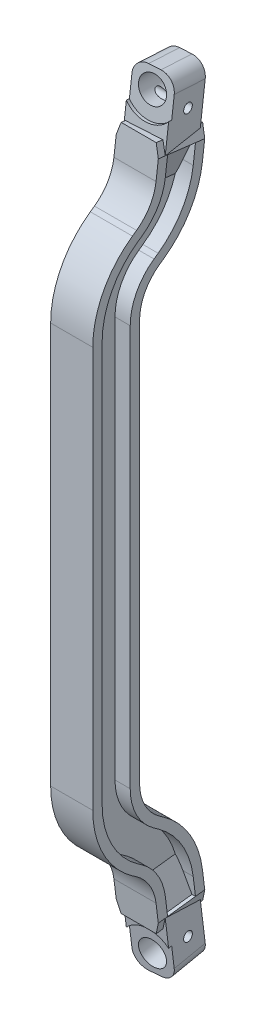
from build123d import *
from OCP.BRepFilletAPI import BRepFilletAPI_MakeChamfer

# Parameters (mm, degrees)
BOSS_EXTRUDE3_DEPTH       = 100
BOSS_EXTRUDE4_START       = -25
BOSS_EXTRUDE4_DEPTH       = 135
FILLET2_R                 = 30
SKETCH8_R                 = 28
CUT_EXTRUDE2_DEPTH        = 85
CHAMFER2_SIZE             = 25
CHAMFER2_SIZE2            = 68.686935486
SKETCH9_R                 = 10
CUT_EXTRUDE3_DEPTH        = 858.264154976
FILLET2_OF_MIRROR1_R      = 30
CHAMFER2_OF_MIRROR1_SIZE  = 25
CHAMFER2_OF_MIRROR1_SIZE2 = 68.686935486
SKETCH10_R                = 55
CUT_EXTRUDE4_DEPTH        = 7
SKETCH11_R                = 55
CUT_EXTRUDE5_DEPTH        = 7


with BuildPart() as part:
    # Sweep3: sweep along a path in Sketch2
    with BuildLine(Plane(origin=(0, 0, 0), x_dir=(0, 0, -1), z_dir=(1, 0, 0))) as sweep3_path:
        Line((40, -707.115), (35.150009844, -667.615))
        ThreePointArc((35.150009844, -667.615), (21.699722473, -628.444195566), (-6.468256478, -598.082589677))
        Line((-6.468256478, -598.082589677), (-15.272697684, -591.87285015))
        ThreePointArc((-15.272697684, -591.87285015), (-77.559200743, -520.481595506), (-100, -428.434160824))
        Line((-100, -428.434160824), (-100, -372.115))
        Line((-100, -372.115), (-100, 0))
    # Sketch1 → Sweep3 (sweep)
    with BuildSketch(Plane(origin=(0, 0, 0), x_dir=(1, 0, 0), z_dir=(0, 1, 0))):
        Polygon((-45, 0), (-45, -20), (-12.5, -20), (-12.5, -80), (-45, -80), (-45, -100), (45, -100), (45, -80), (12.5, -80), (12.5, -20), (45, -20), (45, 0), align=None)
    sweep3 = sweep(path=sweep3_path.line)

    # Sketch6 → Boss-Extrude3 (add)
    with BuildSketch(Plane(origin=(0, 6.523203495, -53.127229086), x_dir=(-1, 0, 0), z_dir=(0, 0.12186934340514098, -0.992546151641323))):
        Polygon((-45, -706.719045754), (45, -706.719045754), (37.5, -731.719045754), (-37.5, -731.719045754), align=None)
    boss_extrude3 = extrude(amount=-BOSS_EXTRUDE3_DEPTH)

    # Sketch7 → Boss-Extrude4 (add)
    with BuildSketch(Plane(origin=(0, -726.264922946, -89.174119663), x_dir=(1, 0, 0), z_dir=(0, -0.992546151641323, -0.12186934340514098)).offset(BOSS_EXTRUDE4_START)):
        Polygon((-39.489238574, 37.473794696), (45, 31.565731599), (39.489238574, -47.241828371), (-45, -41.333765274), align=None)
    boss_extrude4 = extrude(amount=BOSS_EXTRUDE4_DEPTH)

    # Fillet2
    fillet2_edges = [part.edges().sort_by_distance(p)[0] for p in [
        (-42.244619287, -835.209793586, -104.495346909),
        (42.244619287, -834.489781816, -110.3593722),
    ]]
    fillet(fillet2_edges, radius=FILLET2_R)

    # Sketch8 → Cut-Extrude2 (cut)
    with BuildSketch(Plane(origin=(-3.095242597, 5.394428439, -43.934093987), x_dir=(-0.9975640426646005, -0.00837869546975235, 0.06925155770727769), z_dir=(-0.06975647374412558, 0.12157247580973782, -0.9901283591011198))):
        with Locations(Location((-0.444559855, -801.718997, 0), (0, 0, 89.992929705))):
            Circle(SKETCH8_R)
    cut_extrude2 = extrude(amount=-CUT_EXTRUDE2_DEPTH, mode=Mode.SUBTRACT)

    # Chamfer2: one chamfer whose edges measure the first distance from different faces: ONE call of the kernel's chamfer builder (chamfer() names one face for all edges)
    chamfer2_edges_1 = [part.edges().sort_by_distance(p)[0] for p in [
        (12.5, -701.02153283, -89.627307582),
    ]]
    chamfer2_side_1 = [part.faces().sort_by_distance(p)[0] for p in [
        (28.75, -701.02153283, -89.627307582),
    ]]
    chamfer2_edges_2 = [part.edges().sort_by_distance(p)[0] for p in [
        (-12.5, -701.02153283, -89.627307582),
    ]]
    chamfer2_side_2 = [part.faces().sort_by_distance(p)[0] for p in [
        (-28.75, -701.02153283, -89.627307582),
    ]]
    chamfer2 = BRepFilletAPI_MakeChamfer(part.part.solid().wrapped)
    for e in chamfer2_edges_1:
        chamfer2.Add(CHAMFER2_SIZE, CHAMFER2_SIZE2, e.wrapped, chamfer2_side_1[0].wrapped)  # the first distance lies on this face
    for e in chamfer2_edges_2:
        chamfer2.Add(CHAMFER2_SIZE, CHAMFER2_SIZE2, e.wrapped, chamfer2_side_2[0].wrapped)  # the first distance lies on this face
    add(Compound.cast(chamfer2.Shape()), mode=Mode.REPLACE)

    # Sketch9 → Cut-Extrude3 (cut, through all)
    with BuildSketch(Plane(origin=(-41.904757403, -0.357109604, 2.908424331), x_dir=(0.06923400560903198, 0.0005900076719097519, 0.9976002728339021), z_dir=(-0.9975640502598241, -0.008501175653454889, 0.06923651956680364))):
        with Locations(Location((-103.821376482, -766.779055644, 0), (0, 0, 359.966193827))):
            Circle(SKETCH9_R)
    cut_extrude3 = extrude(amount=-CUT_EXTRUDE3_DEPTH, mode=Mode.SUBTRACT)

    # Mirror1: Sweep3, Boss-Extrude3, Boss-Extrude4, Cut-Extrude2, Cut-Extrude3 across plane
    add(sweep3.mirror(Plane.ZX))
    add(boss_extrude3.mirror(Plane.ZX))
    add(boss_extrude4.mirror(Plane.ZX))
    add(cut_extrude2.mirror(Plane.ZX), mode=Mode.SUBTRACT)
    add(cut_extrude3.mirror(Plane.ZX), mode=Mode.SUBTRACT)

    # Fillet2 of Mirror1
    fillet2_of_mirror1_edges = [part.edges().sort_by_distance(p)[0] for p in [
        (-42.244619287, 835.209793586, -104.495346909),
        (42.244619287, 834.489781816, -110.3593722),
    ]]
    fillet(fillet2_of_mirror1_edges, radius=FILLET2_OF_MIRROR1_R)

    # Chamfer2 of Mirror1: one chamfer whose edges measure the first distance from different faces: ONE call of the kernel's chamfer builder (chamfer() names one face for all edges)
    chamfer2_of_mirror1_edges_1 = [part.edges().sort_by_distance(p)[0] for p in [
        (12.5, 701.02153283, -89.627307582),
    ]]
    chamfer2_of_mirror1_side_1 = [part.faces().sort_by_distance(p)[0] for p in [
        (28.75, 701.02153283, -89.627307582),
    ]]
    chamfer2_of_mirror1_edges_2 = [part.edges().sort_by_distance(p)[0] for p in [
        (-12.5, 701.02153283, -89.627307582),
    ]]
    chamfer2_of_mirror1_side_2 = [part.faces().sort_by_distance(p)[0] for p in [
        (-28.75, 701.02153283, -89.627307582),
    ]]
    chamfer2_of_mirror1 = BRepFilletAPI_MakeChamfer(part.part.solid().wrapped)
    for e in chamfer2_of_mirror1_edges_1:
        chamfer2_of_mirror1.Add(CHAMFER2_OF_MIRROR1_SIZE, CHAMFER2_OF_MIRROR1_SIZE2, e.wrapped, chamfer2_of_mirror1_side_1[0].wrapped)  # the first distance lies on this face
    for e in chamfer2_of_mirror1_edges_2:
        chamfer2_of_mirror1.Add(CHAMFER2_OF_MIRROR1_SIZE, CHAMFER2_OF_MIRROR1_SIZE2, e.wrapped, chamfer2_of_mirror1_side_2[0].wrapped)  # the first distance lies on this face
    add(Compound.cast(chamfer2_of_mirror1.Shape()), mode=Mode.REPLACE)

    # Sketch10 → Cut-Extrude4 (cut)
    with BuildSketch(Plane(origin=(2.415518829, 4.20979715, 34.286046382), x_dir=(0.9975640502598243, -0.008501175653454538, -0.06923651956680081), z_dir=(0.06975647374412557, 0.12157247580973786, 0.9901283591011197))):
        with Locations((0.345627789, 801.719045754)):
            Circle(SKETCH10_R)
    extrude(amount=-CUT_EXTRUDE4_DEPTH, mode=Mode.SUBTRACT)

    # Sketch11 → Cut-Extrude5 (cut)
    with BuildSketch(Plane(origin=(2.415518829, -4.20979715, 34.286046382), x_dir=(0.9975640502598243, 0.008501175653454538, -0.06923651956680081), z_dir=(0.06975647374412557, -0.12157247580973786, 0.9901283591011197))):
        with Locations((0.345627789, -801.719045754)):
            Circle(SKETCH11_R)
    extrude(amount=-CUT_EXTRUDE5_DEPTH, mode=Mode.SUBTRACT)


solid = part.part
